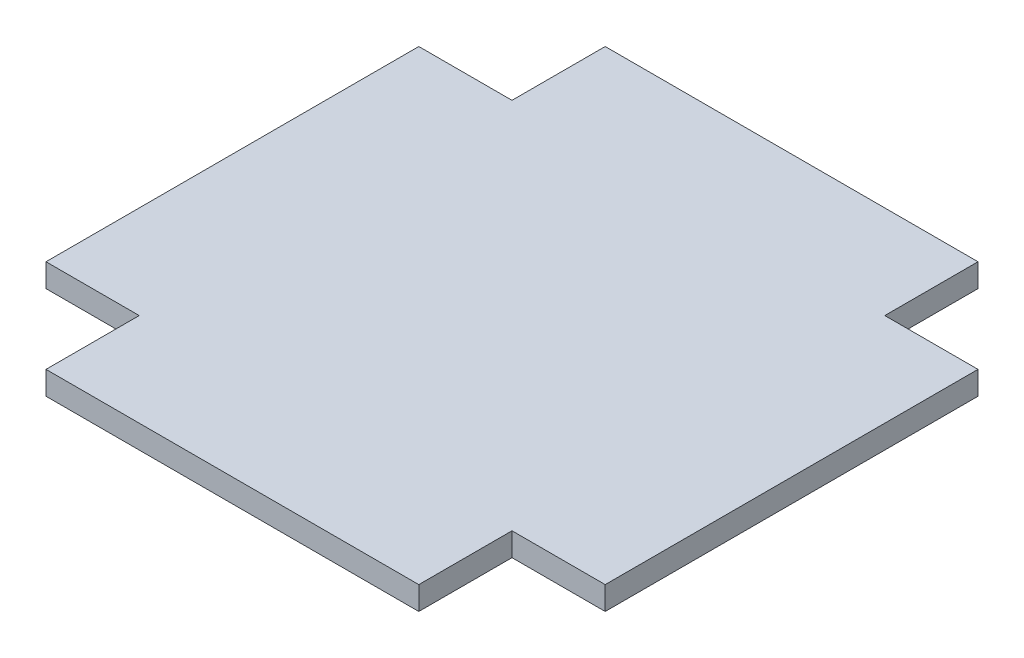
from build123d import *

# Parameters (mm, degrees)
BOSS_EXTRUDE1_DEPTH = 2.5


with BuildPart() as part:
    # Sketch1 → Boss-Extrude1 (new body)
    with BuildSketch(Plane(origin=(0, 0, 0), x_dir=(1, 0, 0), z_dir=(0, 1, 0))):
        Polygon((-20, 30), (-20, 20), (-30, 20), (-30, -20), (-20, -20), (-20, -30), (20, -30), (20, -20), (30, -20), (30, 20), (20, 20), (20, 30), align=None)
    extrude(amount=BOSS_EXTRUDE1_DEPTH)


solid = part.part
